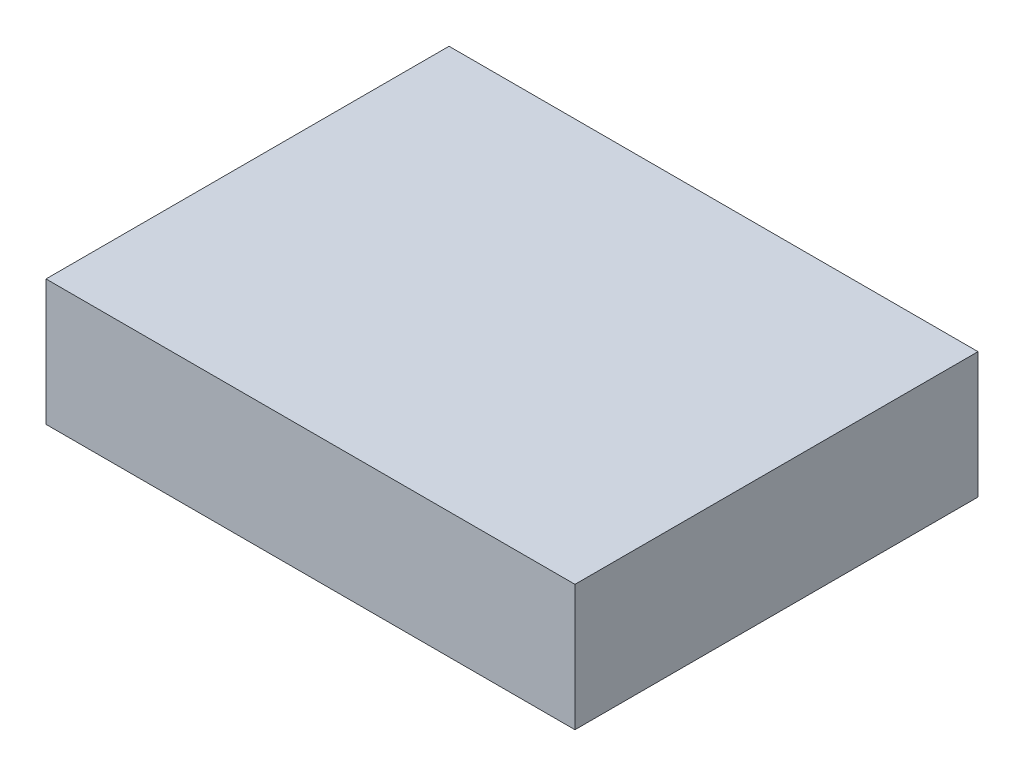
from build123d import *

# Parameters (mm, degrees)
SKETCH2_W           = 21
SKETCH2_H           = 16
BOSS_EXTRUDE1_DEPTH = 5


with BuildPart() as part:
    # Sketch2 → Boss-Extrude1 (new body)
    with BuildSketch(Plane(origin=(0, 0, 0), x_dir=(1, 0, 0), z_dir=(0, 1, 0))):
        Rectangle(SKETCH2_W, SKETCH2_H)
    extrude(amount=BOSS_EXTRUDE1_DEPTH)


solid = part.part
